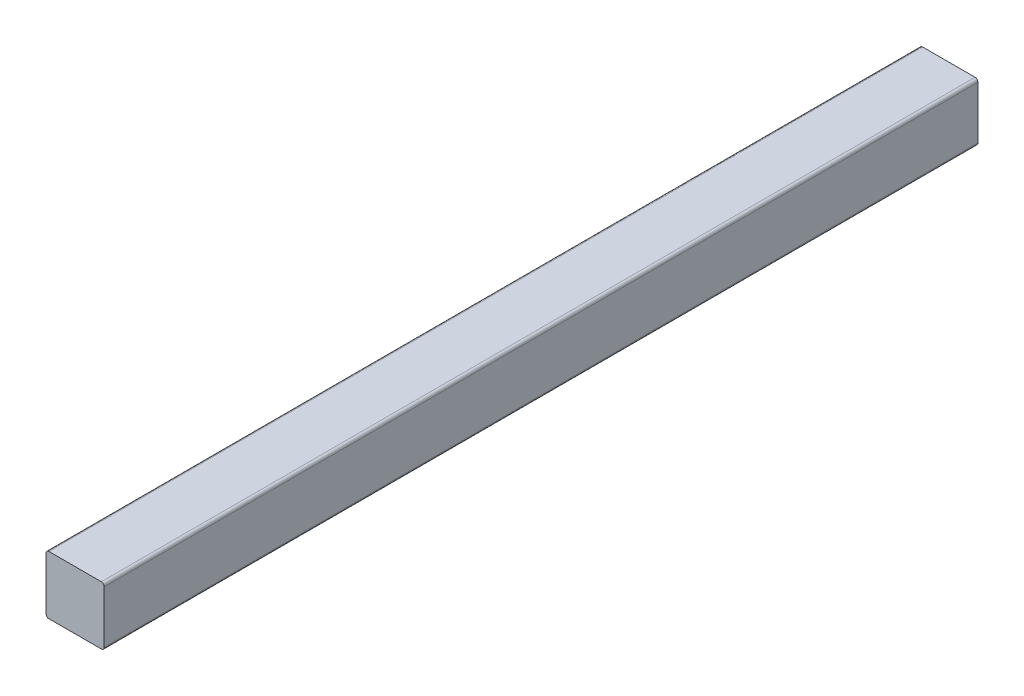
from build123d import *

# Parameters (mm, degrees)
BOSS_EXTRUDE1_DEPTH = 300


with BuildPart() as part:
    # Sketch1 → Boss-Extrude1 (new body)
    with BuildSketch(Plane.XY):
        with BuildLine():
            Line((1, 0), (19, 0))
            ThreePointArc((19, 0), (19.707106781, 0.292893219), (20, 1))
            Line((20, 1), (20, 19))
            ThreePointArc((20, 19), (19.707106781, 19.707106781), (19, 20))
            Line((19, 20), (1, 20))
            ThreePointArc((1, 20), (0.292893219, 19.707106781), (0, 19))
            Line((0, 19), (0, 1))
            ThreePointArc((0, 1), (0.292893219, 0.292893219), (1, 0))
        make_face()
    extrude(amount=BOSS_EXTRUDE1_DEPTH)


solid = part.part
